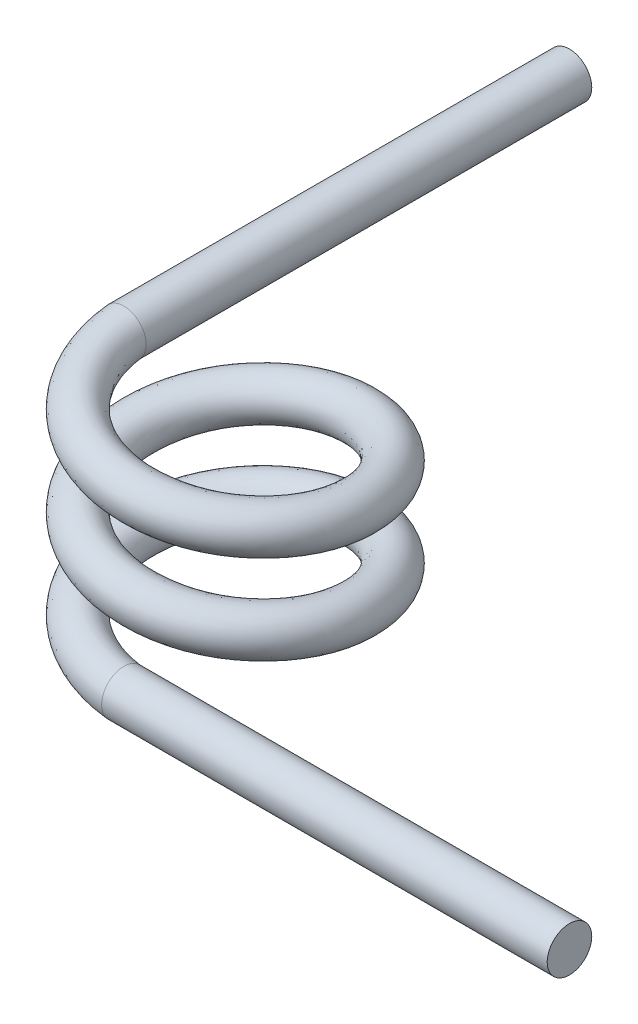
from build123d import *

# Parameters (mm, degrees)
SWEEP1_PITCH            = 1
SWEEP1_HEIGHT           = 2.5
SWEEP1_RADIUS           = 1.25
SWEEP1_START_ANGLE      = 90
SKETCH5_R               = 0.25
SKETCH6_R               = 0.25
BOSS_EXTRUDE1_DEPTH     = 5
CUT_EXTRUDE3_DEPTH      = 6.900213984
CUT_EXTRUDE3_DEPTH_BACK = 6.900213984
SKETCH11_R              = 0.25
BOSS_EXTRUDE3_DEPTH     = 5


with BuildPart() as part:
    # Sweep1: sweep along a helix
    with BuildLine() as sweep1_path:
        add(Helix(SWEEP1_PITCH, SWEEP1_HEIGHT, SWEEP1_RADIUS, center=(0, 0, 0), direction=(0, 1, 0), lefthand=True, mode=Mode.PRIVATE).rotate(Axis((0, 0, 0), (0, 1, 0)), SWEEP1_START_ANGLE))
    # Sketch5 → Sweep1 (sweep)
    with BuildSketch(Plane.XY):
        with Locations((-1.25, 2.5)):
            Circle(SKETCH5_R)
    sweep(path=sweep1_path.line, is_frenet=True)

    # Sketch6 → Boss-Extrude1 (add)
    with BuildSketch(Plane(origin=(0, 0, 0), x_dir=(-1, 0, 0), z_dir=(0, 0, -1))):
        with Locations(Location((1.249917128, 2.498189297, 0), (0, 0, 179.584887185))):
            Circle(SKETCH6_R)
    extrude(amount=BOSS_EXTRUDE1_DEPTH)

    # Sketch10 → Cut-Extrude3 (cut, two sides: drawn at the far end of the back side and taken through both)
    with BuildSketch(Plane.XY.offset(-CUT_EXTRUDE3_DEPTH_BACK)):
        Polygon((0, 0), (0, 0.476713955), (1.596533829, 0.476713955), (1.596533829, -0.338868321), (0, -0.310206334), align=None)
    extrude(amount=CUT_EXTRUDE3_DEPTH + CUT_EXTRUDE3_DEPTH_BACK, mode=Mode.SUBTRACT)

    # Sketch11 → Boss-Extrude3 (add)
    with BuildSketch(Plane(origin=(0, 0, 0), x_dir=(0, 0, -1), z_dir=(1, 0, 0))):
        with Locations(Location((-1.25, 0.25, 0), (0, 0, 65.074402292))):
            Circle(SKETCH11_R)
    extrude(amount=BOSS_EXTRUDE3_DEPTH)


solid = part.part
